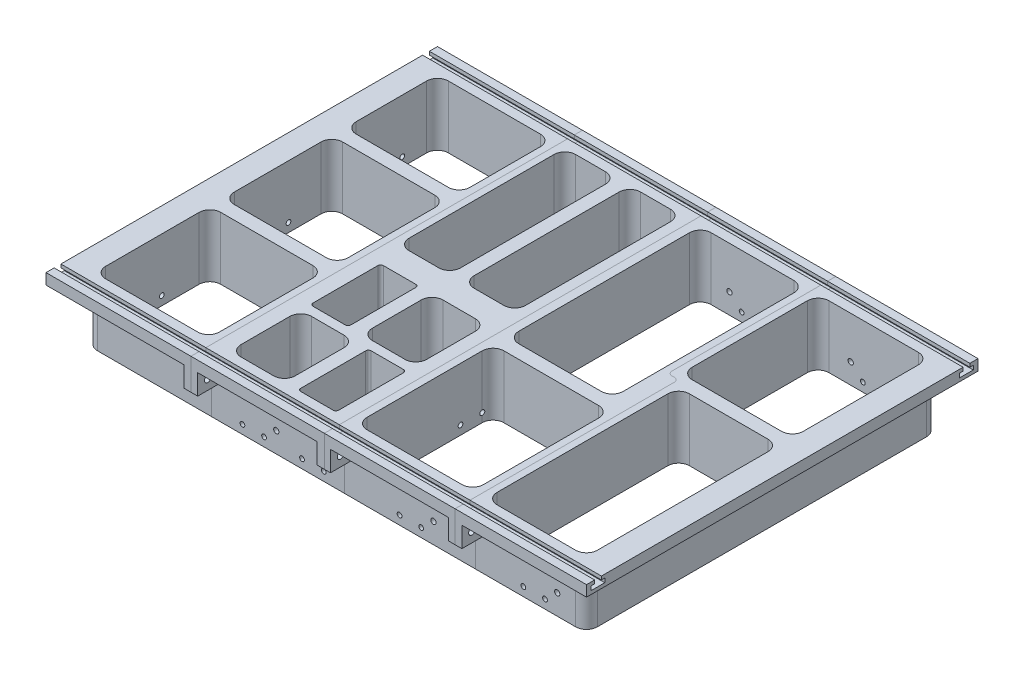
from build123d import *

# Parameters (mm, degrees)
SKETCH1_W                  = 399
SKETCH1_H                  = 289
BOSS_EXTRUDE1_DEPTH        = 53
SKETCH3_OUTSIDE_W          = 500.102
SKETCH3_OUTSIDE_H          = 390.102
SKETCH3_OUTSIDE_W_2        = 369
SKETCH3_OUTSIDE_H_2        = 259
CUT_EXTRUDE2_DEPTH         = 45
MINI_BIN_CUTS_DEPTH        = 46
FILLET1_R                  = 8
SKETCH6_W                  = 259
SKETCH6_H                  = 7
CUT_EXTRUDE5_DEPTH         = 414.697050993
SKETCH7_R                  = 1.75
SKETCH7_R_2                = 1.95
HOLES_LIDS_1_2_3_DEPTH     = 3
SKETCH8_R                  = 1.75
SKETCH8_R_2                = 1.95
HOLES_LIDS_8_9_12_13_DEPTH = 3
SKETCH9_R                  = 1.75
SKETCH9_R_2                = 1.95
HOLES_LIDS_4_5_10_11_DEPTH = 3
HOLE_LID_7_REACH           = 256.751
SKETCH11_R                 = 1.75
HOLE_START                 = -15
SKETCH12_R                 = 1.75
HOLE_LID_6_DEPTH           = 15
SKETCH13_R                 = 1.95
SERVO_BRACKETS_6_7_DEPTH   = 15
STRUCTURAL_CUTS_DEPTH      = 428.656696441
SKETCH16_W                 = 10
SKETCH16_H                 = 15
FIRST_SET_OF_BOLTS_DEPTH   = 15
SKETCH17_W                 = 10
SKETCH17_H                 = 15
SECOND_SET_OF_BOLTS_DEPTH  = 15
SKETCH18_R                 = 2.5
CUT_EXTRUDE6_DEPTH         = 414.697051005
CHAMFER2_SIZE              = 2
SPLIT1_SURFACE_1_1_BACK    = 495.811
SPLIT1_SURFACE_1_1_DEPTH   = 991.622
SPLIT1_SURFACE_1_2_BACK    = 495.811
SPLIT1_SURFACE_1_2_DEPTH   = 991.622
SPLIT1_SURFACE_2_3_BACK    = 495.811
SPLIT1_SURFACE_2_3_DEPTH   = 991.622
SPLIT1_SURFACE_2_4_BACK    = 495.811
SPLIT1_SURFACE_2_4_DEPTH   = 991.622
SPLIT1_SURFACE_3_5_BACK    = 495.811
SPLIT1_SURFACE_3_5_DEPTH   = 991.622
SPLIT1_SURFACE_3_6_BACK    = 495.811
SPLIT1_SURFACE_3_6_DEPTH   = 991.622


with BuildPart() as part:
    # Sketch1 → Boss-Extrude1 (new body)
    with BuildSketch(Plane(origin=(0, 0, 0), x_dir=(1, 0, 0), z_dir=(0, 1, 0))):
        Rectangle(SKETCH1_W, SKETCH1_H)
    extrude(amount=BOSS_EXTRUDE1_DEPTH)

    # Sketch3 outside → Cut-Extrude2 (cut)
    with BuildSketch(Plane(origin=(0, 0, 0), x_dir=(-1, 0, 0), z_dir=(0, -1, 0))):
        Rectangle(SKETCH3_OUTSIDE_W, SKETCH3_OUTSIDE_H)
        Rectangle(SKETCH3_OUTSIDE_W_2, SKETCH3_OUTSIDE_H_2, mode=Mode.SUBTRACT)
    extrude(amount=-CUT_EXTRUDE2_DEPTH, mode=Mode.SUBTRACT)

    # Sketch2 → Mini bin cuts (cut)
    with BuildSketch(Plane(origin=(0, 53, 0), x_dir=(1, 0, 0), z_dir=(0, 1, 0))):
        with BuildLine():
            Line((-173.5, -126.5), (-105.5, -126.5))
            ThreePointArc((-105.5, -126.5), (-99.843145751, -124.156854249), (-97.5, -118.5))
            Line((-97.5, -118.5), (-97.5, -49.5))
            ThreePointArc((-97.5, -49.5), (-99.843145751, -43.843145751), (-105.5, -41.5))
            Line((-105.5, -41.5), (-173.5, -41.5))
            ThreePointArc((-173.5, -41.5), (-179.156854249, -43.843145751), (-181.5, -49.5))
            Line((-181.5, -49.5), (-181.5, -118.5))
            ThreePointArc((-181.5, -118.5), (-179.156854249, -124.156854249), (-173.5, -126.5))
        make_face()
        with BuildLine():
            Line((-173.5, -31.5), (-105.5, -31.5))
            ThreePointArc((-105.5, -31.5), (-99.843145751, -29.156854249), (-97.5, -23.5))
            Line((-97.5, -23.5), (-97.5, 40.5))
            ThreePointArc((-97.5, 40.5), (-99.843145751, 46.156854249), (-105.5, 48.5))
            Line((-105.5, 48.5), (-173.5, 48.5))
            ThreePointArc((-173.5, 48.5), (-179.156854249, 46.156854249), (-181.5, 40.5))
            Line((-181.5, 40.5), (-181.5, -23.5))
            ThreePointArc((-181.5, -23.5), (-179.156854249, -29.156854249), (-173.5, -31.5))
        make_face()
        with BuildLine():
            Line((-173.5, 126.5), (-105.5, 126.5))
            ThreePointArc((-105.5, 126.5), (-99.843145751, 124.156854249), (-97.5, 118.5))
            Line((-97.5, 118.5), (-97.5, 66.5))
            ThreePointArc((-97.5, 66.5), (-99.843145751, 60.843145751), (-105.5, 58.5))
            Line((-105.5, 58.5), (-173.5, 58.5))
            ThreePointArc((-173.5, 58.5), (-179.156854249, 60.843145751), (-181.5, 66.5))
            Line((-181.5, 66.5), (-181.5, 118.5))
            ThreePointArc((-181.5, 118.5), (-179.156854249, 124.156854249), (-173.5, 126.5))
        make_face()
        with BuildLine():
            Line((173.5, -126.5), (115.5, -126.5))
            ThreePointArc((115.5, -126.5), (109.843145751, -124.156854249), (107.5, -118.5))
            Line((107.5, -118.5), (107.5, 7.5))
            ThreePointArc((107.5, 7.5), (109.843145751, 13.156854249), (115.5, 15.5))
            Line((115.5, 15.5), (173.5, 15.5))
            ThreePointArc((173.5, 15.5), (179.156854249, 13.156854249), (181.5, 7.5))
            Line((181.5, 7.5), (181.5, -118.5))
            ThreePointArc((181.5, -118.5), (179.156854249, -124.156854249), (173.5, -126.5))
        make_face()
        with BuildLine():
            Line((173.5, 126.5), (107.5, 126.5))
            ThreePointArc((107.5, 126.5), (101.843145751, 124.156854249), (99.5, 118.5))
            Line((99.5, 118.5), (99.5, 33.5))
            ThreePointArc((99.5, 33.5), (101.843145751, 27.843145751), (107.5, 25.5))
            Line((107.5, 25.5), (173.5, 25.5))
            ThreePointArc((173.5, 25.5), (179.156854249, 27.843145751), (181.5, 33.5))
            Line((181.5, 33.5), (181.5, 118.5))
            ThreePointArc((181.5, 118.5), (179.156854249, 124.156854249), (173.5, 126.5))
        make_face()
        with BuildLine():
            Line((81.5, 126.5), (20.5, 126.5))
            ThreePointArc((20.5, 126.5), (14.843145751, 124.156854249), (12.5, 118.5))
            Line((12.5, 118.5), (12.5, -7.5))
            ThreePointArc((12.5, -7.5), (14.843145751, -13.156854249), (20.5, -15.5))
            Line((20.5, -15.5), (81.5, -15.5))
            ThreePointArc((81.5, -15.5), (87.156854249, -13.156854249), (89.5, -7.5))
            Line((89.5, -7.5), (89.5, 118.5))
            ThreePointArc((89.5, 118.5), (87.156854249, 124.156854249), (81.5, 126.5))
        make_face()
        with BuildLine():
            Line((-9.5, 126.5), (-31.5, 126.5))
            ThreePointArc((-31.5, 126.5), (-37.156854249, 124.156854249), (-39.5, 118.5))
            Line((-39.5, 118.5), (-39.5, 11.5))
            ThreePointArc((-39.5, 11.5), (-37.156854249, 5.843145751), (-31.5, 3.5))
            Line((-31.5, 3.5), (-9.5, 3.5))
            ThreePointArc((-9.5, 3.5), (-3.843145751, 5.843145751), (-1.5, 11.5))
            Line((-1.5, 11.5), (-1.5, 118.5))
            ThreePointArc((-1.5, 118.5), (-3.843145751, 124.156854249), (-9.5, 126.5))
        make_face()
        with BuildLine():
            Line((-57.5, 126.5), (-79.5, 126.5))
            ThreePointArc((-79.5, 126.5), (-85.156854249, 124.156854249), (-87.5, 118.5))
            Line((-87.5, 118.5), (-87.5, 11.5))
            ThreePointArc((-87.5, 11.5), (-85.156854249, 5.843145751), (-79.5, 3.5))
            Line((-79.5, 3.5), (-57.5, 3.5))
            ThreePointArc((-57.5, 3.5), (-51.843145751, 5.843145751), (-49.5, 11.5))
            Line((-49.5, 11.5), (-49.5, 118.5))
            ThreePointArc((-49.5, 118.5), (-51.843145751, 124.156854249), (-57.5, 126.5))
        make_face()
        with BuildLine():
            Line((-79.5, -15.5), (-55.5, -15.5))
            ThreePointArc((-55.5, -15.5), (-54.085786438, -16.085786438), (-53.5, -17.5))
            Line((-53.5, -17.5), (-53.5, -65.5))
            ThreePointArc((-53.5, -65.5), (-54.085786438, -66.914213562), (-55.5, -67.5))
            Line((-55.5, -67.5), (-79.5, -67.5))
            ThreePointArc((-79.5, -67.5), (-80.914213562, -66.914213562), (-81.5, -65.5))
            Line((-81.5, -65.5), (-81.5, -17.5))
            ThreePointArc((-81.5, -17.5), (-80.914213562, -16.085786438), (-79.5, -15.5))
        make_face()
        with BuildLine():
            Line((-73.5, -126.5), (-49.5, -126.5))
            ThreePointArc((-49.5, -126.5), (-43.843145751, -124.156854249), (-41.5, -118.5))
            Line((-41.5, -118.5), (-41.5, -82.5))
            ThreePointArc((-41.5, -82.5), (-43.843145751, -76.843145751), (-49.5, -74.5))
            Line((-49.5, -74.5), (-73.5, -74.5))
            ThreePointArc((-73.5, -74.5), (-79.156854249, -76.843145751), (-81.5, -82.5))
            Line((-81.5, -82.5), (-81.5, -118.5))
            ThreePointArc((-81.5, -118.5), (-79.156854249, -124.156854249), (-73.5, -126.5))
        make_face()
        with BuildLine():
            Line((-35.5, -15.5), (-11.5, -15.5))
            ThreePointArc((-11.5, -15.5), (-5.843145751, -17.843145751), (-3.5, -23.5))
            Line((-3.5, -23.5), (-3.5, -59.5))
            ThreePointArc((-3.5, -59.5), (-5.843145751, -65.156854249), (-11.5, -67.5))
            Line((-11.5, -67.5), (-35.5, -67.5))
            ThreePointArc((-35.5, -67.5), (-41.156854249, -65.156854249), (-43.5, -59.5))
            Line((-43.5, -59.5), (-43.5, -23.5))
            ThreePointArc((-43.5, -23.5), (-41.156854249, -17.843145751), (-35.5, -15.5))
        make_face()
        with BuildLine():
            Line((-29.5, -74.5), (-5.5, -74.5))
            ThreePointArc((-5.5, -74.5), (-4.085786438, -75.085786438), (-3.5, -76.5))
            Line((-3.5, -76.5), (-3.5, -124.5))
            ThreePointArc((-3.5, -124.5), (-4.085786438, -125.914213562), (-5.5, -126.5))
            Line((-5.5, -126.5), (-29.5, -126.5))
            ThreePointArc((-29.5, -126.5), (-30.914213562, -125.914213562), (-31.5, -124.5))
            Line((-31.5, -124.5), (-31.5, -76.5))
            ThreePointArc((-31.5, -76.5), (-30.914213562, -75.085786438), (-29.5, -74.5))
        make_face()
        with BuildLine():
            Line((89.5, -126.5), (19.5, -126.5))
            ThreePointArc((19.5, -126.5), (13.843145751, -124.156854249), (11.5, -118.5))
            Line((11.5, -118.5), (11.5, -33.5))
            ThreePointArc((11.5, -33.5), (13.843145751, -27.843145751), (19.5, -25.5))
            Line((19.5, -25.5), (89.5, -25.5))
            ThreePointArc((89.5, -25.5), (95.156854249, -27.843145751), (97.5, -33.5))
            Line((97.5, -33.5), (97.5, -118.5))
            ThreePointArc((97.5, -118.5), (95.156854249, -124.156854249), (89.5, -126.5))
        make_face()
    extrude(amount=-MINI_BIN_CUTS_DEPTH, mode=Mode.SUBTRACT)

    # Fillet1
    fillet1_edges = [part.edges().sort_by_distance(p)[0] for p in [
        (184.5, 22.5, 129.5),
        (184.5, 22.5, -129.5),
        (-184.5, 22.5, -129.5),
        (-184.5, 22.5, 129.5),
    ]]
    fillet(fillet1_edges, radius=FILLET1_R)

    # Sketch6 → Cut-Extrude5 (cut, through all)
    with BuildSketch(Plane.ZY.offset(184.5)):
        with Locations((0, 3.5)):
            Rectangle(SKETCH6_W, SKETCH6_H)
    extrude(amount=-CUT_EXTRUDE5_DEPTH, mode=Mode.SUBTRACT)

    # Sketch7 → Holes Lids 1,2,3 (cut)
    with BuildSketch(Plane.ZY.offset(184.5)):
        with Locations((-100.5, 13.5)):
            Circle(SKETCH7_R)
        with Locations((-84.5, 13.5)):
            Circle(SKETCH7_R)
        with Locations((-16.5, 13.5)):
            Circle(SKETCH7_R)
        with Locations((77, 13.5)):
            Circle(SKETCH7_R)
        with Locations((-0.5, 13.5)):
            Circle(SKETCH7_R)
        with Locations((93, 13.5)):
            Circle(SKETCH7_R)
        with Locations((-75.5, 21.963)):
            Circle(SKETCH7_R_2)
        with Locations((102, 21.963)):
            Circle(SKETCH7_R_2)
        with Locations((8.5, 21.963)):
            Circle(SKETCH7_R_2)
    extrude(amount=-HOLES_LIDS_1_2_3_DEPTH, mode=Mode.SUBTRACT)

    # Sketch8 → Holes Lids 8,9,12,13 (cut)
    with BuildSketch(Plane.XY.offset(129.5)):
        with Locations((-69.5, 13.5)):
            Circle(SKETCH8_R)
        with Locations((-25.5, 13.5)):
            Circle(SKETCH8_R)
        with Locations((46.5, 13.5)):
            Circle(SKETCH8_R)
        with Locations((137.896, 13.5)):
            Circle(SKETCH8_R)
        with Locations((153.896, 13.5)):
            Circle(SKETCH8_R)
        with Locations((62.5, 13.5)):
            Circle(SKETCH8_R)
        with Locations((-9.5, 13.5)):
            Circle(SKETCH8_R)
        with Locations((-53.5, 13.5)):
            Circle(SKETCH8_R)
        with Locations((-44.5, 21.96)):
            Circle(SKETCH8_R_2)
        with Locations((-0.5, 21.96)):
            Circle(SKETCH8_R_2)
        with Locations((71.5, 21.96)):
            Circle(SKETCH8_R_2)
        with Locations((162.896, 21.96)):
            Circle(SKETCH8_R_2)
    extrude(amount=-HOLES_LIDS_8_9_12_13_DEPTH, mode=Mode.SUBTRACT)

    # Sketch9 → Holes Lids 4,5,10,11 (cut)
    with BuildSketch(Plane(origin=(0, 0, -129.5), x_dir=(-1, 0, 0), z_dir=(0, 0, -1))):
        with Locations((-148.5, 13.5)):
            Circle(SKETCH9_R)
        with Locations((-59, 13.5)):
            Circle(SKETCH9_R)
        with Locations((12.5, 13.5)):
            Circle(SKETCH9_R)
        with Locations((60.5, 13.5)):
            Circle(SKETCH9_R)
        with Locations((-132.5, 13.5)):
            Circle(SKETCH9_R)
        with Locations((-43, 13.5)):
            Circle(SKETCH9_R)
        with Locations((28.5, 13.5)):
            Circle(SKETCH9_R)
        with Locations((76.5, 13.5)):
            Circle(SKETCH9_R)
        with Locations((-123.5, 21.96)):
            Circle(SKETCH9_R_2)
        with Locations((-34, 21.96)):
            Circle(SKETCH9_R_2)
        with Locations((37.5, 21.96)):
            Circle(SKETCH9_R_2)
        with Locations((85.5, 21.96)):
            Circle(SKETCH9_R_2)
    extrude(amount=-HOLES_LIDS_4_5_10_11_DEPTH, mode=Mode.SUBTRACT)

    # Sketch11 → Hole Lid 7 (cut, up to next)
    with BuildSketch(Plane.ZY.offset(3.5), mode=Mode.PRIVATE) as hole_lid_7_sk1:
        with Locations((33.5, 13.5)):
            Circle(SKETCH11_R)
    hole_lid_7_tool1 = extrude(hole_lid_7_sk1.sketch, amount=-HOLE_LID_7_REACH, mode=Mode.PRIVATE) & part.part
    # Sketch11 → Hole Lid 7 (cut, up to next)
    with BuildSketch(Plane.ZY.offset(3.5), mode=Mode.PRIVATE) as hole_lid_7_sk2:
        with Locations((49.5, 13.5)):
            Circle(SKETCH11_R)
    hole_lid_7_tool2 = extrude(hole_lid_7_sk2.sketch, amount=-HOLE_LID_7_REACH, mode=Mode.PRIVATE) & part.part
    add(hole_lid_7_tool1.solids().sort_by_distance((-3.5, 13.5, 33.5))[0], mode=Mode.SUBTRACT)
    add(hole_lid_7_tool2.solids().sort_by_distance((-3.5, 13.5, 49.5))[0], mode=Mode.SUBTRACT)

    # Sketch12 → Hole Lid 6 (cut)
    with BuildSketch(Plane(origin=(-81.5, 0, 0), x_dir=(0, 0, -1), z_dir=(1, 0, 0)).offset(HOLE_START)):
        with Locations(Location((-49.5, 13.5, 0), (0, 0, 180))):
            Circle(SKETCH12_R)
        with Locations(Location((-33.5, 13.5, 0), (0, 0, 180))):
            Circle(SKETCH12_R)
    extrude(amount=HOLE_LID_6_DEPTH, mode=Mode.SUBTRACT)

    # Sketch13 → Servo brackets 6,7, (cut)
    with BuildSketch(Plane.XZ.offset(-7)):
        with Locations(Location((-88.5, 45.5, 0), (0, 0, 270))):
            Circle(SKETCH13_R)
        with Locations(Location((3.5, 18.84, 0), (0, 0, 270))):
            Circle(SKETCH13_R)
        with Locations(Location((3.5, 58.97, 0), (0, 0, 90))):
            Circle(SKETCH13_R)
        with Locations(Location((-88.5, 5.36, 0), (0, 0, 90))):
            Circle(SKETCH13_R)
    extrude(amount=-SERVO_BRACKETS_6_7_DEPTH, mode=Mode.SUBTRACT)

    # Sketch14 → Structural Cuts (cut, through all)
    with BuildSketch(Plane.ZY.offset(199.5)):
        Polygon((133.5, 53), (133.5, 50.5), (131, 50.5), (131, 47.5), (141, 47.5), (141, 50.5), (138.5, 50.5), (138.5, 53), align=None)
        Polygon((-138.5, 53), (-133.5, 53), (-133.5, 50.5), (-131, 50.5), (-131, 47.5), (-141, 47.5), (-141, 50.5), (-138.5, 50.5), align=None)
    extrude(amount=-STRUCTURAL_CUTS_DEPTH, mode=Mode.SUBTRACT)

    # Sketch16 → First Set of Bolts (add)
    with BuildSketch(Plane.XY.offset(129.5)):
        with Locations((5.5, 37.5)):
            Rectangle(SKETCH16_W, SKETCH16_H)
        with Locations((102.5, 37.5)):
            Rectangle(SKETCH16_W, SKETCH16_H)
        with Locations((-92.5, 37.5)):
            Rectangle(SKETCH16_W, SKETCH16_H)
    extrude(amount=FIRST_SET_OF_BOLTS_DEPTH)

    # Sketch17 → Second Set of Bolts (add)
    with BuildSketch(Plane(origin=(0, 0, -129.5), x_dir=(-1, 0, 0), z_dir=(0, 0, -1))):
        with Locations((-102.5, 37.5)):
            Rectangle(SKETCH17_W, SKETCH17_H)
        with Locations((-5.5, 37.5)):
            Rectangle(SKETCH17_W, SKETCH17_H)
        with Locations((92.5, 37.5)):
            Rectangle(SKETCH17_W, SKETCH17_H)
    extrude(amount=SECOND_SET_OF_BOLTS_DEPTH)

    # Sketch18 → Cut-Extrude6 (cut, through all)
    with BuildSketch(Plane.ZY.offset(184.5)):
        with Locations(Location((137, 37.5, 0), (0, 0, 90))):
            Circle(SKETCH18_R)
        with Locations(Location((-137, 37.5, 0), (0, 0, 270))):
            Circle(SKETCH18_R)
    extrude(amount=-CUT_EXTRUDE6_DEPTH, mode=Mode.SUBTRACT)

    # Chamfer2
    chamfer2_edges = [part.edges().sort_by_distance(p)[0] for p in [
        (97.5, 35, 137),
        (0.5, 35, 137),
        (-97.5, 35, 137),
        (-97.5, 40, -137),
        (0.5, 40, -137),
        (97.5, 40, -137),
    ]]
    chamfer(chamfer2_edges, length=CHAMFER2_SIZE)


with BuildPart() as body_2:
    # Split1: the piece behind the surface
    add(part.part)
    # Split1 surface 1: a surface, the sketch's curves swept straight by 991.622 mm
    with BuildLine(Plane(origin=(0, 53, 0), x_dir=(1, 0, 0), z_dir=(0, 1, 0)).offset(-SPLIT1_SURFACE_1_1_BACK), mode=Mode.PRIVATE) as split1_surface_1_1_path:
        Line((-92.5, 144.5), (-92.5, -144.5))
    split1_surface_1_1 = Shell.extrude(split1_surface_1_1_path.wire(), (0 * SPLIT1_SURFACE_1_1_DEPTH, 1 * SPLIT1_SURFACE_1_1_DEPTH, 0 * SPLIT1_SURFACE_1_1_DEPTH))
    split(bisect_by=split1_surface_1_1, keep=Keep.BOTTOM)


with BuildPart() as part_1:
    add(part.part)

    # Split1: split by a surface, the side it looks to stays
    # Split1 surface 1: a surface, the sketch's curves swept straight by 991.622 mm
    with BuildLine(Plane(origin=(0, 53, 0), x_dir=(1, 0, 0), z_dir=(0, 1, 0)).offset(-SPLIT1_SURFACE_1_2_BACK), mode=Mode.PRIVATE) as split1_surface_1_2_path:
        Line((-92.5, 144.5), (-92.5, -144.5))
    split1_surface_1_2 = Shell.extrude(split1_surface_1_2_path.wire(), (0 * SPLIT1_SURFACE_1_2_DEPTH, 1 * SPLIT1_SURFACE_1_2_DEPTH, 0 * SPLIT1_SURFACE_1_2_DEPTH))
    split(bisect_by=split1_surface_1_2, keep=Keep.TOP)


with BuildPart() as body_3:
    # Split1 2: the piece behind the surface
    add(part_1.part)
    # Split1 surface 2: a surface, the sketch's curves swept straight by 991.622 mm
    with BuildLine(Plane(origin=(0, 53, 0), x_dir=(1, 0, 0), z_dir=(0, 1, 0)).offset(-SPLIT1_SURFACE_2_3_BACK), mode=Mode.PRIVATE) as split1_surface_2_3_path:
        Line((6, 144.5), (6, -144.5))
    split1_surface_2_3 = Shell.extrude(split1_surface_2_3_path.wire(), (0 * SPLIT1_SURFACE_2_3_DEPTH, 1 * SPLIT1_SURFACE_2_3_DEPTH, 0 * SPLIT1_SURFACE_2_3_DEPTH))
    split(bisect_by=split1_surface_2_3, keep=Keep.BOTTOM)


with BuildPart() as part_2:
    add(part_1.part)

    # Split1 2: split by a surface, the side it looks to stays
    # Split1 surface 2: a surface, the sketch's curves swept straight by 991.622 mm
    with BuildLine(Plane(origin=(0, 53, 0), x_dir=(1, 0, 0), z_dir=(0, 1, 0)).offset(-SPLIT1_SURFACE_2_4_BACK), mode=Mode.PRIVATE) as split1_surface_2_4_path:
        Line((6, 144.5), (6, -144.5))
    split1_surface_2_4 = Shell.extrude(split1_surface_2_4_path.wire(), (0 * SPLIT1_SURFACE_2_4_DEPTH, 1 * SPLIT1_SURFACE_2_4_DEPTH, 0 * SPLIT1_SURFACE_2_4_DEPTH))
    split(bisect_by=split1_surface_2_4, keep=Keep.TOP)


with BuildPart() as body_4_2:
    # Split1 3: the piece behind the surface
    add(part_2.part)
    # Split1 surface 3: a surface, the sketch's curves swept straight by 991.622 mm
    with BuildLine(Plane(origin=(0, 53, 0), x_dir=(1, 0, 0), z_dir=(0, 1, 0)).offset(-SPLIT1_SURFACE_3_5_BACK), mode=Mode.PRIVATE) as split1_surface_3_5_path:
        Line((94.5, 144.5), (94.5, 23.5))
        ThreePointArc((94.5, 23.5), (95.378679656, 21.378679656), (97.5, 20.5))
        Line((97.5, 20.5), (99.5, 20.5))
        ThreePointArc((99.5, 20.5), (101.621320344, 19.621320344), (102.5, 17.5))
        Line((102.5, 17.5), (102.5, -144.5))
    split1_surface_3_5 = Shell.extrude(split1_surface_3_5_path.wire(), (0 * SPLIT1_SURFACE_3_5_DEPTH, 1 * SPLIT1_SURFACE_3_5_DEPTH, 0 * SPLIT1_SURFACE_3_5_DEPTH))
    split(bisect_by=split1_surface_3_5, keep=Keep.BOTTOM)


with BuildPart() as part_3:
    add(part_2.part)

    # Split1 3: split by a surface, the side it looks to stays
    # Split1 surface 3: a surface, the sketch's curves swept straight by 991.622 mm
    with BuildLine(Plane(origin=(0, 53, 0), x_dir=(1, 0, 0), z_dir=(0, 1, 0)).offset(-SPLIT1_SURFACE_3_6_BACK), mode=Mode.PRIVATE) as split1_surface_3_6_path:
        Line((94.5, 144.5), (94.5, 23.5))
        ThreePointArc((94.5, 23.5), (95.378679656, 21.378679656), (97.5, 20.5))
        Line((97.5, 20.5), (99.5, 20.5))
        ThreePointArc((99.5, 20.5), (101.621320344, 19.621320344), (102.5, 17.5))
        Line((102.5, 17.5), (102.5, -144.5))
    split1_surface_3_6 = Shell.extrude(split1_surface_3_6_path.wire(), (0 * SPLIT1_SURFACE_3_6_DEPTH, 1 * SPLIT1_SURFACE_3_6_DEPTH, 0 * SPLIT1_SURFACE_3_6_DEPTH))
    split(bisect_by=split1_surface_3_6, keep=Keep.TOP)


solid = Compound([body_2.part, body_3.part, body_4_2.part, part_3.part])
